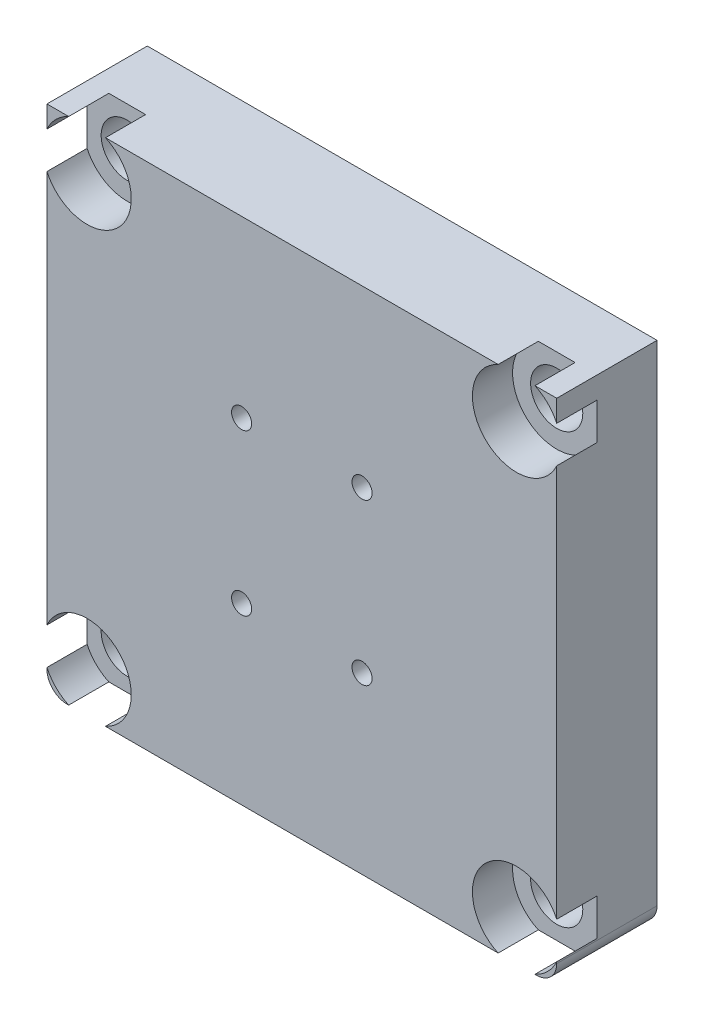
from build123d import *

# Parameters (mm, degrees)
BOSS_EXTRUDE1_DEPTH            = 5
F_1_0MM_DOWEL_HOLE1_D          = 1
CBORE_FOR_M2_SHCS1_D           = 2.6
CBORE_FOR_M2_SHCS1_CBORE_D     = 4.4
CBORE_FOR_M2_SHCS1_CBORE_DEPTH = 2


with BuildPart() as part:
    # Sketch1 → Boss-Extrude1 (new body)
    with BuildSketch(Plane.XY):
        with BuildLine():
            Line((-12.7, 12.7), (-12.7, -11.7))
            ThreePointArc((-12.7, -11.7), (-12.407106781, -12.407106781), (-11.7, -12.7))
            Line((-11.7, -12.7), (11.7, -12.7))
            ThreePointArc((11.7, -12.7), (12.407106781, -12.407106781), (12.7, -11.7))
            Line((12.7, -11.7), (12.7, 12.7))
            Line((12.7, 12.7), (-12.7, 12.7))
        make_face()
    extrude(amount=BOSS_EXTRUDE1_DEPTH)

    # Ø1.0mm Dowel Hole1 (through all)
    with Locations(Plane.XY.offset(5)):
        with Locations((3, -4), (-3, -4), (-3, 4), (3, 4)):
            Hole(F_1_0MM_DOWEL_HOLE1_D / 2)

    # CBORE for M2 SHCS1 (through all)
    with Locations(Plane.XY.offset(5)):
        with Locations((10.7, -10.7), (-10.7, -10.7), (-10.7, 10.7), (10.7, 10.7)):
            CounterBoreHole(CBORE_FOR_M2_SHCS1_D / 2, CBORE_FOR_M2_SHCS1_CBORE_D / 2, CBORE_FOR_M2_SHCS1_CBORE_DEPTH)


solid = part.part
